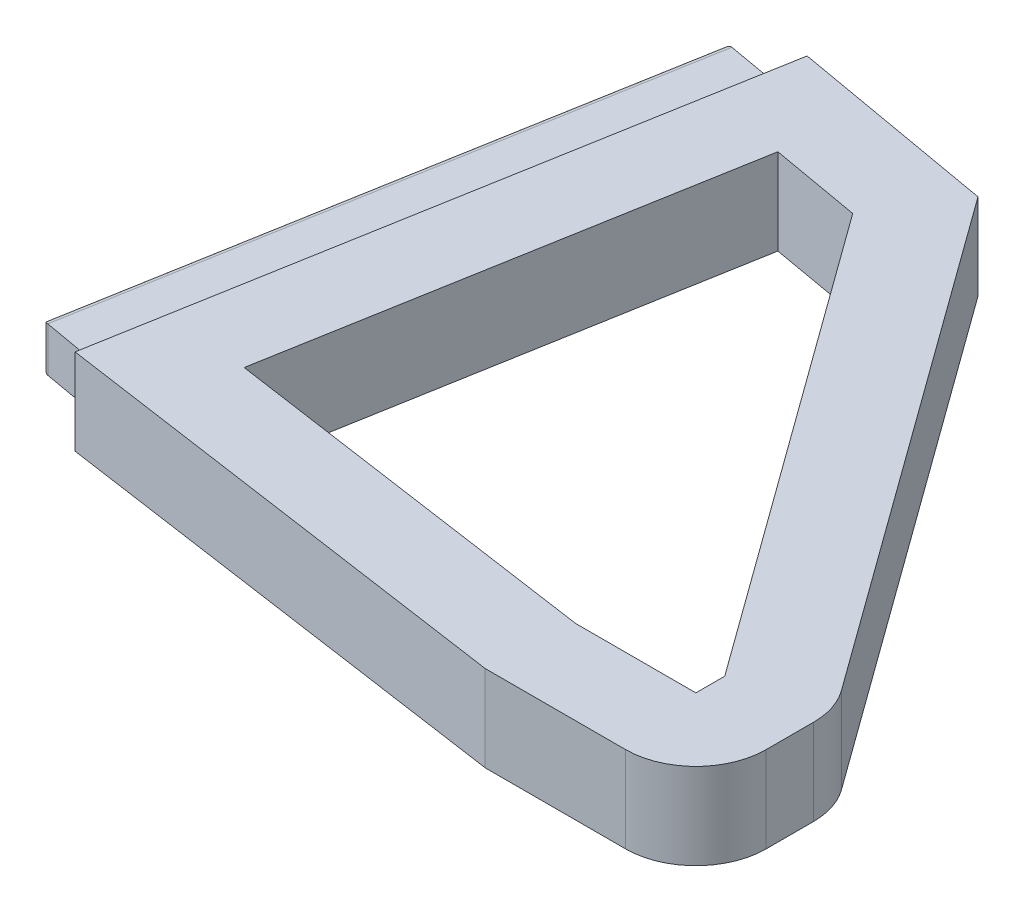
from build123d import *

# Parameters (mm, degrees)
BOSS_EXTRUDE1_DEPTH = 12.25
SKETCH2_W           = 84.1
SKETCH2_H           = 6.35
BOSS_EXTRUDE2_DEPTH = 10
FILLET1_R           = 1


with BuildPart() as part:
    # Sketch1 → Boss-Extrude1 (new body)
    with BuildSketch(Plane(origin=(0, 0, 0), x_dir=(1, 0, 0), z_dir=(0, 1, 0))):
        with BuildLine():
            Line((17.364817767, 98.480775301), (46.909050357, 93.271329971))
            Line((46.909050357, 93.271329971), (98.097719862, 22.625355106))
            ThreePointArc((98.097719862, 22.625355106), (99.512549569, 19.841964096), (100, 16.757908213))
            Line((100, 16.757908213), (100, 10))
            ThreePointArc((100, 10), (97.071067812, 2.928932188), (90, 0))
            Line((90, 0), (70, 0))
            Line((70, 0), (1.736481777, 9.84807753))
            Line((1.736481777, 9.84807753), (17.364817767, 98.480775301))
        make_face()
        Polygon((40.041775538, 82.297096463), (88, 16.109489855), (88, 12), (70.861136072, 12), (15.704122693, 19.957259723), (27.098732671, 84.579304133), align=None, mode=Mode.SUBTRACT)
    extrude(amount=BOSS_EXTRUDE1_DEPTH)

    # Sketch2 → Boss-Extrude2 (add)
    with BuildSketch(Plane(origin=(0, 0, 0), x_dir=(-0.17364817766692336, 0, 0.9848077530122094), z_dir=(-0.9848077530122092, 0, -0.17364817766692334))):
        with Locations((-55, 6.125)):
            Rectangle(SKETCH2_W, SKETCH2_H)
    extrude(amount=BOSS_EXTRUDE2_DEPTH)

    # Fillet1
    fillet1_edges = [part.edges().sort_by_distance(p)[0] for p in [
        (-0.297427758, 2.95, -55.900908192),
        (-7.599333629, 6.125, -14.489742178),
        (-0.297427758, 9.3, -55.900908192),
        (7.004478112, 6.125, -97.312074207),
    ]]
    fillet(fillet1_edges, radius=FILLET1_R)


solid = part.part
